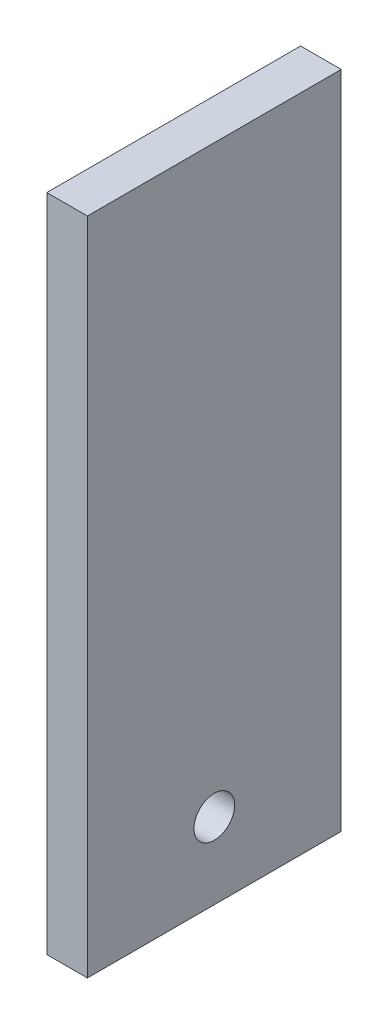
from build123d import *

# Parameters (mm, degrees)
SKETCH1_W           = 50
SKETCH1_H           = 130
BOSS_EXTRUDE1_DEPTH = 8
SKETCH2_R           = 4
CUT_EXTRUDE3_DEPTH  = 8


with BuildPart() as part:
    # Sketch1 → Boss-Extrude1 (new body)
    with BuildSketch(Plane(origin=(0, 0, 0), x_dir=(0, 0, -1), z_dir=(1, 0, 0))):
        with Locations((25, 65)):
            Rectangle(SKETCH1_W, SKETCH1_H)
    extrude(amount=BOSS_EXTRUDE1_DEPTH)

    # Sketch2 → Cut-Extrude3 (cut)
    with BuildSketch(Plane(origin=(0, 0, 0), x_dir=(0, 0, -1), z_dir=(1, 0, 0))):
        with Locations(Location((25, 15, 0), (0, 0, 180))):
            Circle(SKETCH2_R)
    extrude(amount=CUT_EXTRUDE3_DEPTH, mode=Mode.SUBTRACT)


solid = part.part
